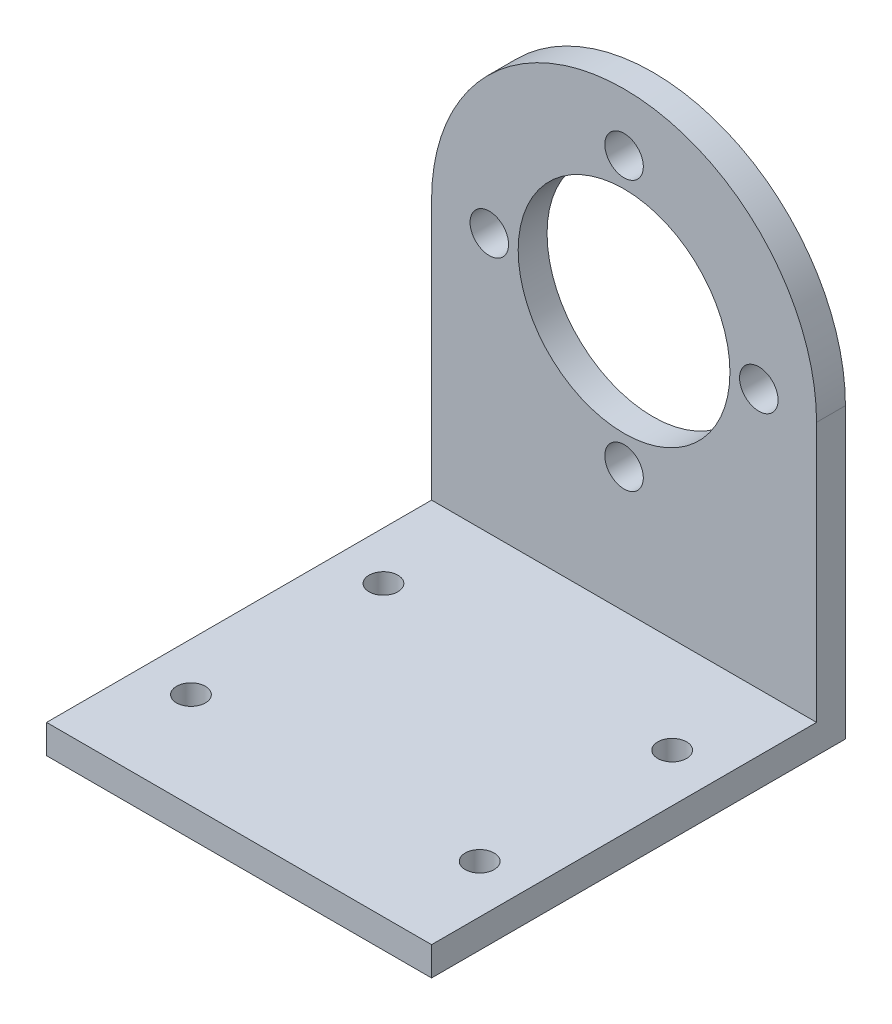
from build123d import *

# Parameters (mm, degrees)
SKETCH_1_W      = 40
SKETCH_1_H      = 43
SKETCH_1_R      = 1.5
EXTRUDE_1_DEPTH = 3
SKETCH_3_R      = 11
SKETCH_3_R_2    = 2
EXTRUDE_2_DEPTH = 3


with BuildPart() as part:
    # 草图1 → 凸台-拉伸1 (new body)
    with BuildSketch(Plane(origin=(0, 0, 0), x_dir=(1, 0, 0), z_dir=(0, 1, 0))):
        Rectangle(SKETCH_1_W, SKETCH_1_H)
        with Locations(Location((-15, -11.5, 0), (0, 0, 270))):
            Circle(SKETCH_1_R, mode=Mode.SUBTRACT)
        with Locations(Location((15, -11.5, 0), (0, 0, 270))):
            Circle(SKETCH_1_R, mode=Mode.SUBTRACT)
        with Locations(Location((15, 8.5, 0), (0, 0, 270))):
            Circle(SKETCH_1_R, mode=Mode.SUBTRACT)
        with Locations(Location((-15, 8.5, 0), (0, 0, 270))):
            Circle(SKETCH_1_R, mode=Mode.SUBTRACT)
    extrude(amount=EXTRUDE_1_DEPTH)

    # 草图3 → 凸台-拉伸2 (add)
    with BuildSketch(Plane(origin=(0, 0, -21.5), x_dir=(-1, 0, 0), z_dir=(0, 0, -1))):
        with BuildLine():
            Line((-20, 0), (-20, 30))
            ThreePointArc((-20, 30), (0, 50), (20, 30))
            Line((20, 30), (20, 0))
            Line((20, 0), (-20, 0))
        make_face()
        with Locations((0, 30)):
            Circle(SKETCH_3_R, mode=Mode.SUBTRACT)
        with Locations((0, 44)):
            Circle(SKETCH_3_R_2, mode=Mode.SUBTRACT)
        with Locations((14, 30)):
            Circle(SKETCH_3_R_2, mode=Mode.SUBTRACT)
        with Locations((0, 16)):
            Circle(SKETCH_3_R_2, mode=Mode.SUBTRACT)
        with Locations((-14, 30)):
            Circle(SKETCH_3_R_2, mode=Mode.SUBTRACT)
    extrude(amount=-EXTRUDE_2_DEPTH)


solid = part.part
